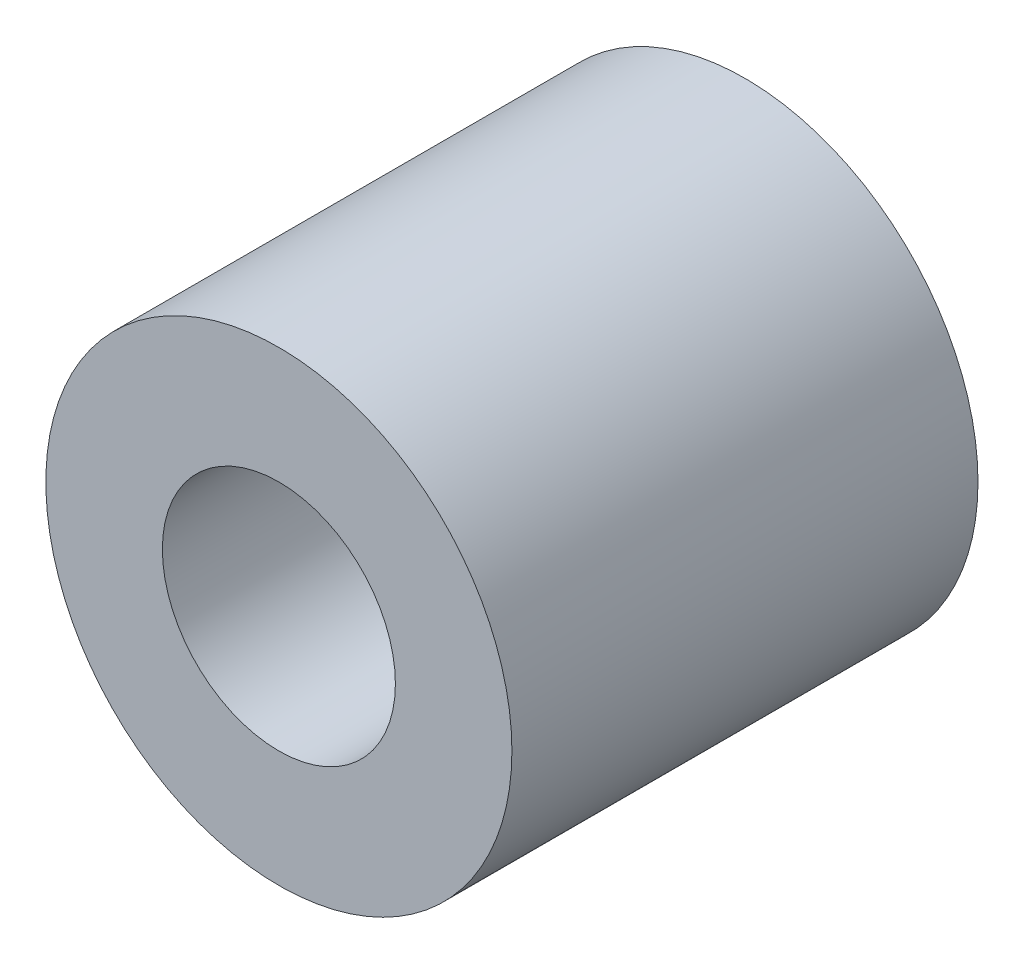
from build123d import *

# Parameters (mm, degrees)
SKETCH_BASE_PROFILE_R    = 10
FEATURE_BASE_DEPTH       = 20
SKETCH_HOLE_PROFILE_R    = 5
FEATURE_BLIND_HOLE_DEPTH = 10


with BuildPart() as part:
    # sketch:base-profile → feature:base (new body)
    with BuildSketch(Plane.XY):
        Circle(SKETCH_BASE_PROFILE_R)
    extrude(amount=FEATURE_BASE_DEPTH)

    # sketch:hole-profile → feature:blind-hole (cut)
    with BuildSketch(Plane.XY.offset(20)):
        Circle(SKETCH_HOLE_PROFILE_R)
    extrude(amount=-FEATURE_BLIND_HOLE_DEPTH, mode=Mode.SUBTRACT)


solid = part.part
